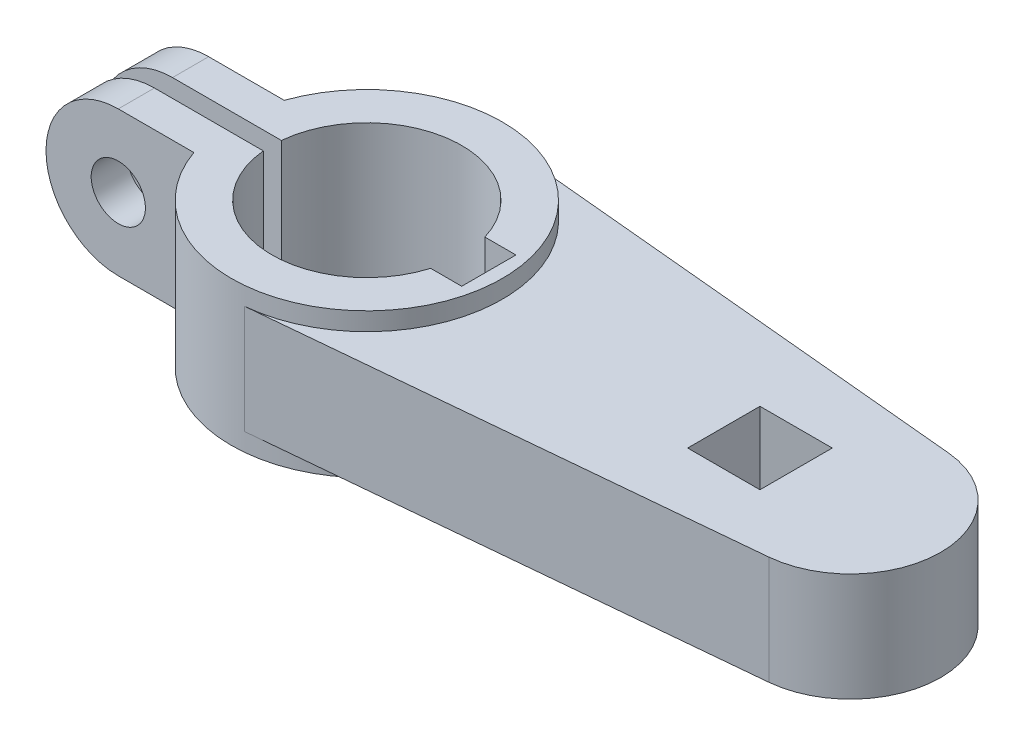
from build123d import *

# Parameters (mm, degrees)
BOSS_EXTRUDE1_DEPTH = 8
BOSS_EXTRUDE2_DEPTH = 6
SKETCH2_R           = 3
CUT_EXTRUDE2_DEPTH  = 12


with BuildPart() as part:
    # Sketch1 → Boss-Extrude1 (new, symmetric)
    with BuildSketch(Plane(origin=(0, 0, 0), x_dir=(1, 0, 0), z_dir=(0, 1, 0))):
        with BuildLine():
            ThreePointArc((1.401869159, -14.934348424), (15, 0), (1.401869159, 14.934348424))
            ThreePointArc((1.401869159, 14.934348424), (-8.077834924, 12.639168602), (-14.142135624, 5))
            Line((-14.142135624, 5), (-30.5, 5))
            Line((-30.5, 5), (-30.5, 1))
            Line((-30.5, 1), (-10.45227248, 1))
            ThreePointArc((-10.45227248, 1), (-1.018831921, 10.450453651), (10.062305899, 3))
            Line((10.062305899, 3), (13.5, 3))
            Line((13.5, 3), (13.5, -3))
            Line((13.5, -3), (10.062305899, -3))
            ThreePointArc((10.062305899, -3), (-1.018831921, -10.450453651), (-10.45227248, -1))
            Line((-10.45227248, -1), (-30.5, -1))
            Line((-30.5, -1), (-30.5, -5))
            Line((-30.5, -5), (-14.142135624, -5))
            ThreePointArc((-14.142135624, -5), (-8.077834924, -12.639168602), (1.401869159, -14.934348424))
        make_face()
    extrude(amount=BOSS_EXTRUDE1_DEPTH, both=True)

    # Sketch1<4> → Boss-Extrude2 (add, symmetric)
    with BuildSketch(Plane(origin=(0, 0, 0), x_dir=(1, 0, 0), z_dir=(0, 1, 0))):
        with BuildLine():
            ThreePointArc((54.434579439, -9.956232283), (63.5, 0), (54.434579439, 9.956232283))
            Line((54.434579439, 9.956232283), (1.401869159, 14.934348424))
            ThreePointArc((1.401869159, 14.934348424), (15, 0), (1.401869159, -14.934348424))
            Line((1.401869159, -14.934348424), (54.434579439, -9.956232283))
        make_face()
    extrude(amount=BOSS_EXTRUDE2_DEPTH, both=True)

    # Sketch2 → Cut-Extrude2 (cut)
    with BuildSketch(Plane.XY.offset(5)):
        with Locations((-22.5, 0)):
            Circle(SKETCH2_R)
        with BuildLine():
            Line((-22.5, 8), (-22.5, 10.643526933))
            Line((-22.5, 10.643526933), (-32.266859183, 10.643526933))
            Line((-32.266859183, 10.643526933), (-32.266859183, -8))
            Line((-32.266859183, -8), (-32.266859183, -9.04856402))
            Line((-32.266859183, -9.04856402), (-22.5, -9.04856402))
            Line((-22.5, -9.04856402), (-22.5, -8))
            ThreePointArc((-22.5, -8), (-30.5, 0), (-22.5, 8))
        make_face()
    extrude(amount=-CUT_EXTRUDE2_DEPTH, mode=Mode.SUBTRACT)

    # Sketch4 → Cut-Loft1 section 0
    with BuildSketch(Plane.XZ.offset(6)):
        with BuildLine():
            Line((38.5, -5), (48.5, -5))
            Line((48.5, -5), (48.5, 5))
            Line((48.5, 5), (38.5, 5))
            Line((38.5, 5), (38.5, -5))
        make_face()
    # Sketch3 → Cut-Loft1 section 1
    with BuildSketch(Plane(origin=(0, 6, 0), x_dir=(1, 0, 0), z_dir=(0, 1, 0))):
        with BuildLine():
            Line((39.5, -4), (47.5, -4))
            Line((47.5, -4), (47.5, 4))
            Line((47.5, 4), (39.5, 4))
            Line((39.5, 4), (39.5, -4))
        make_face()
    loft(mode=Mode.SUBTRACT)


solid = part.part
